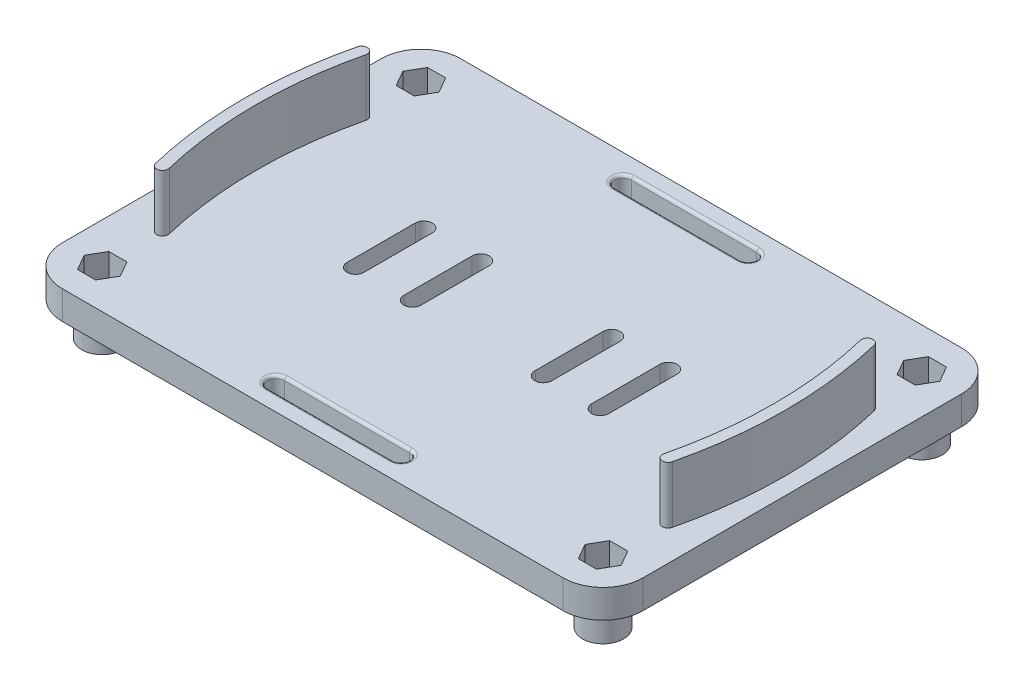
from build123d import *

# Parameters (mm, degrees)
BOSS_EXTRUDE1_DEPTH = 5
CUT_EXTRUDE1_DEPTH  = 12
BOSS_EXTRUDE2_DEPTH = 10
FILLET1_R           = 0.5
BOSS_EXTRUDE3_START = -5
SKETCH4_R           = 3.6
BOSS_EXTRUDE3_DEPTH = 6
SKETCH6_R           = 1.6
CUT_EXTRUDE2_DEPTH  = 63.825154198
CUT_EXTRUDE3_DEPTH  = 6


with BuildPart() as part:
    # Sketch1 → Boss-Extrude1 (new body)
    with BuildSketch(Plane(origin=(0, 0, 0), x_dir=(1, 0, 0), z_dir=(0, 1, 0))):
        with BuildLine():
            Line((-44, -35), (44, -35))
            ThreePointArc((44, -35), (48.949747468, -32.949747468), (51, -28))
            Line((51, -28), (51, 28))
            ThreePointArc((51, 28), (48.949747468, 32.949747468), (44, 35))
            Line((44, 35), (-44, 35))
            ThreePointArc((-44, 35), (-48.949747468, 32.949747468), (-51, 28))
            Line((-51, 28), (-51, -28))
            ThreePointArc((-51, -28), (-48.949747468, -32.949747468), (-44, -35))
        make_face()
    extrude(amount=BOSS_EXTRUDE1_DEPTH)

    # Sketch2 → Cut-Extrude1 (cut)
    with BuildSketch(Plane(origin=(0, 5, 0), x_dir=(1, 0, 0), z_dir=(0, 1, 0))):
        with BuildLine():
            Line((-11, -29), (11, -29))
            ThreePointArc((11, -29), (12.5, -30.5), (11, -32))
            Line((11, -32), (-11, -32))
            ThreePointArc((-11, -32), (-12.5, -30.5), (-11, -29))
        make_face()
        with BuildLine():
            Line((-11, 29), (11, 29))
            ThreePointArc((11, 29), (12.5, 30.5), (11, 32))
            Line((11, 32), (-11, 32))
            ThreePointArc((-11, 32), (-12.5, 30.5), (-11, 29))
        make_face()
        with BuildLine():
            Line((-20, 6), (-20, -6))
            ThreePointArc((-20, -6), (-21.5, -7.5), (-23, -6))
            Line((-23, -6), (-23, 6))
            ThreePointArc((-23, 6), (-21.5, 7.5), (-20, 6))
        make_face()
        with BuildLine():
            Line((-10, 6), (-10, -6))
            ThreePointArc((-10, -6), (-11.5, -7.5), (-13, -6))
            Line((-13, -6), (-13, 6))
            ThreePointArc((-13, 6), (-11.5, 7.5), (-10, 6))
        make_face()
        with BuildLine():
            Line((10, 6), (10, -6))
            ThreePointArc((10, -6), (11.5, -7.5), (13, -6))
            Line((13, -6), (13, 6))
            ThreePointArc((13, 6), (11.5, 7.5), (10, 6))
        make_face()
        with BuildLine():
            Line((20, 6), (20, -6))
            ThreePointArc((20, -6), (21.5, -7.5), (23, -6))
            Line((23, -6), (23, 6))
            ThreePointArc((23, 6), (21.5, 7.5), (20, 6))
        make_face()
    extrude(amount=-CUT_EXTRUDE1_DEPTH, mode=Mode.SUBTRACT)

    # Sketch3 → Boss-Extrude2 (add)
    with BuildSketch(Plane(origin=(0, 5, 0), x_dir=(1, 0, 0), z_dir=(0, 1, 0))):
        with BuildLine():
            ThreePointArc((-44.902157539, 17.733333333), (-47, 0), (-44.902157539, -17.733333333))
            ThreePointArc((-44.902157539, -17.733333333), (-43.696427396, -18.47239681), (-42.957363919, -17.266666667))
            ThreePointArc((-42.957363919, -17.266666667), (-45, 0), (-42.957363919, 17.266666667))
            ThreePointArc((-42.957363919, 17.266666667), (-43.696427396, 18.47239681), (-44.902157539, 17.733333333))
        make_face()
        with BuildLine():
            ThreePointArc((43.957363919, 17.266666667), (46, 0), (43.957363919, -17.266666667))
            ThreePointArc((43.957363919, -17.266666667), (44.696427396, -18.47239681), (45.902157539, -17.733333333))
            ThreePointArc((45.902157539, -17.733333333), (48, 0), (45.902157539, 17.733333333))
            ThreePointArc((45.902157539, 17.733333333), (44.696427396, 18.47239681), (43.957363919, 17.266666667))
        make_face()
    extrude(amount=BOSS_EXTRUDE2_DEPTH)

    # Fillet1
    fillet1_edges = [part.edges().sort_by_distance(p)[0] for p in [
        (0, 0, -29),
        (12.5, 0, -30.5),
        (0, 0, -32),
        (-12.5, 0, -30.5),
        (0, 0, 32),
        (12.5, 0, 30.5),
        (0, 0, 29),
        (-12.5, 0, 30.5),
        (-12.5, 5, 30.5),
        (0, 5, 32),
        (12.5, 5, 30.5),
        (0, 5, 29),
        (-12.5, 5, -30.5),
        (0, 5, -29),
        (12.5, 5, -30.5),
        (0, 5, -32),
    ]]
    fillet(fillet1_edges, radius=FILLET1_R)

    # Sketch4 → Boss-Extrude3 (add)
    with BuildSketch(Plane(origin=(0, 5, 0), x_dir=(1, 0, 0), z_dir=(0, 1, 0)).offset(BOSS_EXTRUDE3_START)):
        with Locations(Location((-44, 28, 0), (0, 0, 90))):
            Circle(SKETCH4_R)
        with Locations(Location((-44, -28, 0), (0, 0, 90))):
            Circle(SKETCH4_R)
        with Locations(Location((44, -28, 0), (0, 0, 90))):
            Circle(SKETCH4_R)
        with Locations(Location((44, 28, 0), (0, 0, 90))):
            Circle(SKETCH4_R)
    extrude(amount=-BOSS_EXTRUDE3_DEPTH)

    # Sketch6 → Cut-Extrude2 (cut, through all)
    with BuildSketch(Plane(origin=(0, 5, 0), x_dir=(1, 0, 0), z_dir=(0, 1, 0))):
        with Locations(Location((-44, 28, 0), (0, 0, 270))):
            Circle(SKETCH6_R)
        with Locations(Location((44, 28, 0), (0, 0, 270))):
            Circle(SKETCH6_R)
        with Locations(Location((44, -28, 0), (0, 0, 90))):
            Circle(SKETCH6_R)
        with Locations(Location((-44, -28, 0), (0, 0, 90))):
            Circle(SKETCH6_R)
    extrude(amount=-CUT_EXTRUDE2_DEPTH, mode=Mode.SUBTRACT)

    # Sketch7 → Cut-Extrude3 (cut)
    with BuildSketch(Plane(origin=(0, 5, 0), x_dir=(1, 0, 0), z_dir=(0, 1, 0))):
        Polygon((-42.41228676, 30.75), (-45.58771324, 30.75), (-47.175426481, 28), (-45.58771324, 25.25), (-42.41228676, 25.25), (-40.824573519, 28), align=None)
        Polygon((40.824573519, 28), (42.41228676, 30.75), (45.58771324, 30.75), (47.175426481, 28), (45.58771324, 25.25), (42.41228676, 25.25), align=None)
        Polygon((42.41228676, -30.75), (45.58771324, -30.75), (47.175426481, -28), (45.58771324, -25.25), (42.41228676, -25.25), (40.824573519, -28), align=None)
        Polygon((-40.824573519, -28), (-42.41228676, -30.75), (-45.58771324, -30.75), (-47.175426481, -28), (-45.58771324, -25.25), (-42.41228676, -25.25), align=None)
    extrude(amount=-CUT_EXTRUDE3_DEPTH, mode=Mode.SUBTRACT)


solid = part.part
